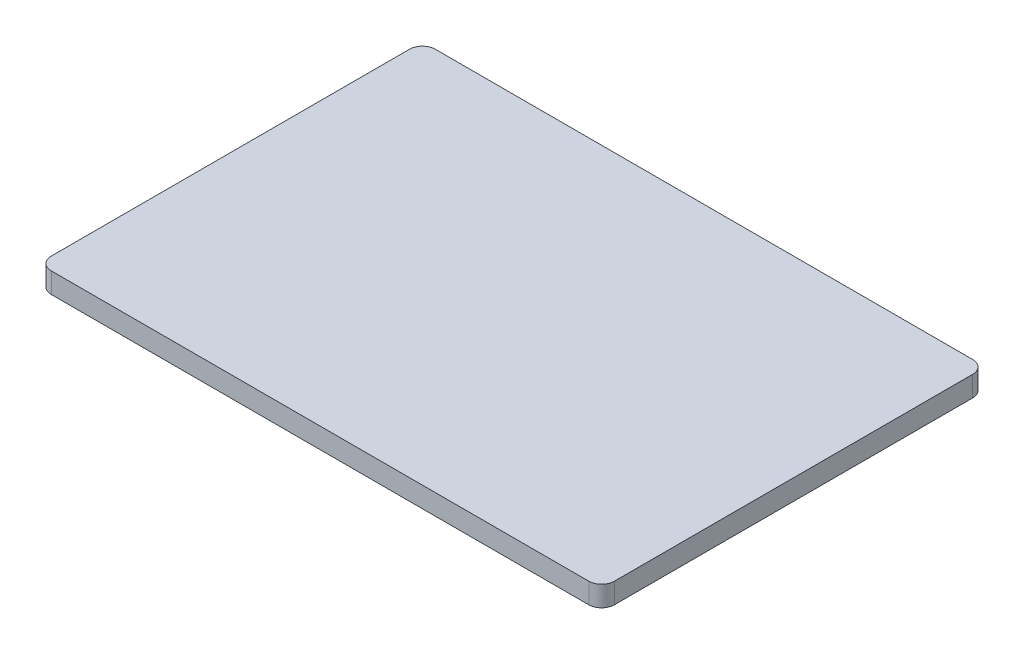
from build123d import *

# Parameters (mm, degrees)
SKETCH1_W           = 220
SKETCH1_H           = 150
BOSS_EXTRUDE1_DEPTH = 4
FILLET1_R           = 5


with BuildPart() as part:
    # Sketch1 → Boss-Extrude1 (new, symmetric)
    with BuildSketch(Plane(origin=(0, 0, 0), x_dir=(1, 0, 0), z_dir=(0, 1, 0))):
        Rectangle(SKETCH1_W, SKETCH1_H)
    extrude(amount=BOSS_EXTRUDE1_DEPTH, both=True)

    # Fillet1
    fillet1_edges = [part.edges().sort_by_distance(p)[0] for p in [
        (110, 0, 75),
        (-110, 0, 75),
        (-110, 0, -75),
        (110, 0, -75),
    ]]
    fillet(fillet1_edges, radius=FILLET1_R)


solid = part.part
